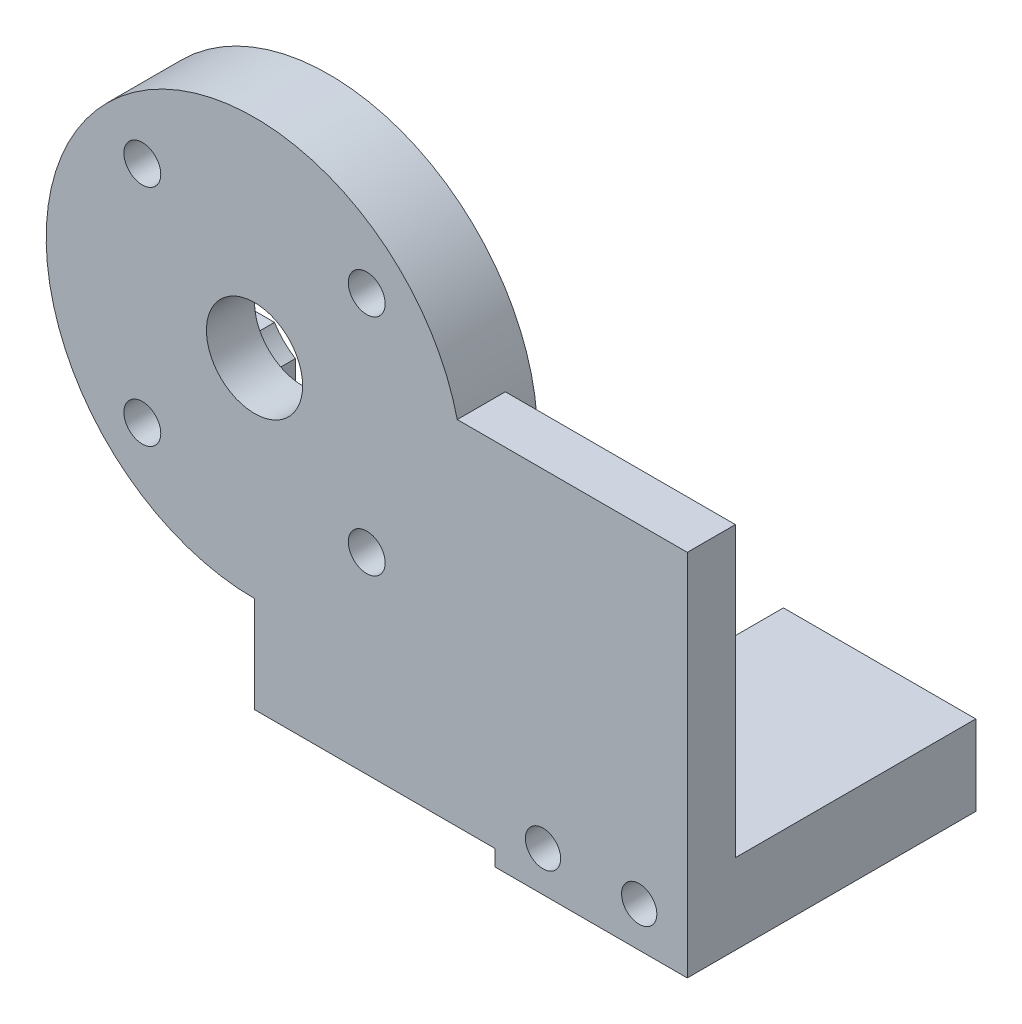
from build123d import *

# Parameters (mm, degrees)
STOCK_HORN_ATTACHMENT_START          = 15
STOCK_HORN_ATTACHMENT_PROFILE_R      = 13
STOCK_HORN_ATTACHMENT_DEPTH          = 3
FINGER_ARM_START                     = 15
FINGER_ARM_PROFILE_W                 = 27
FINGER_ARM_PROFILE_H                 = 22
FINGER_ARM_DEPTH                     = 3
DESCENDING_CONTACT_FINGER_PROFILE_W  = 12
DESCENDING_CONTACT_FINGER_PROFILE_H  = 5
DESCENDING_CONTACT_FINGER_DEPTH      = 18
HORN_CENTER_ACCESS_START             = -50
HORN_CENTER_ACCESS_PROFILE_R         = 3
HORN_CENTER_ACCESS_DEPTH             = 89.118237105
CAPTURED_HORN_KEY_BOSS_START         = 13.35
CAPTURED_HORN_KEY_BOSS_PROFILE_R     = 13
CAPTURED_HORN_KEY_BOSS_DEPTH         = 1.65
KEY_POCKET_HUB_START                 = 13.35
STOCK_HORN_POCKET_HUB_R              = 3.55
KEY_POCKET_HUB_DEPTH                 = 1.65
KEY_POCKET_HORIZONTAL_START          = 13.35
STOCK_HORN_POCKET_HORIZONTAL_W       = 16.3
STOCK_HORN_POCKET_HORIZONTAL_H       = 4.2
KEY_POCKET_HORIZONTAL_DEPTH          = 1.65
KEY_POCKET_VERTICAL_START            = 13.35
STOCK_HORN_POCKET_VERTICAL_W         = 4.2
STOCK_HORN_POCKET_VERTICAL_H         = 16.3
KEY_POCKET_VERTICAL_DEPTH            = 1.65
KEY_POCKET_ROUNDED_TIPS_START        = 13.35
STOCK_HORN_POCKET_ROUNDED_TIPS_R     = 2.1
KEY_POCKET_ROUNDED_TIPS_DEPTH        = 1.65
UNMODIFIED_HORN_CAPTURE_M2_START     = -50
UNMODIFIED_HORN_CAPTURE_M2_PROFILE_R = 1.15
UNMODIFIED_HORN_CAPTURE_M2_DEPTH     = 89.118237105
HUB_CLEARANCE_IN_KEY_BOSS_ONLY_START = 13.35
HORN_CENTER_HUB_CLEARANCE_R          = 4
HUB_CLEARANCE_IN_KEY_BOSS_ONLY_DEPTH = 1.65
CONTACT_PAD_KEEPER_START             = -50
CONTACT_PAD_KEEPER_PROFILE_R         = 1.1
CONTACT_PAD_KEEPER_DEPTH             = 89.118237105


with BuildPart() as part:
    # Stock_horn_attachment_profile → Stock_horn_attachment (new body)
    with BuildSketch(Plane.XY.offset(STOCK_HORN_ATTACHMENT_START)):
        Circle(STOCK_HORN_ATTACHMENT_PROFILE_R)
    extrude(amount=STOCK_HORN_ATTACHMENT_DEPTH)

    # Finger_arm_profile → Finger_arm (add)
    with BuildSketch(Plane.XY.offset(FINGER_ARM_START)):
        with Locations((13.5, -8)):
            Rectangle(FINGER_ARM_PROFILE_W, FINGER_ARM_PROFILE_H)
    extrude(amount=FINGER_ARM_DEPTH)

    # Descending_contact_finger_profile → Descending_contact_finger (add)
    with BuildSketch(Plane.XY):
        with Locations((21, -17.5)):
            Rectangle(DESCENDING_CONTACT_FINGER_PROFILE_W, DESCENDING_CONTACT_FINGER_PROFILE_H)
    extrude(amount=DESCENDING_CONTACT_FINGER_DEPTH)

    # Horn_center_access_profile → Horn_center_access (cut, through all)
    with BuildSketch(Plane.XY.offset(HORN_CENTER_ACCESS_START)):
        Circle(HORN_CENTER_ACCESS_PROFILE_R)
    extrude(amount=HORN_CENTER_ACCESS_DEPTH, mode=Mode.SUBTRACT)

    # Captured_horn_key_boss_profile → Captured_horn_key_boss (add)
    with BuildSketch(Plane.XY.offset(CAPTURED_HORN_KEY_BOSS_START)):
        with Locations(Location((0, 0, 0), (0, 0, 270))):
            Circle(CAPTURED_HORN_KEY_BOSS_PROFILE_R)
    extrude(amount=CAPTURED_HORN_KEY_BOSS_DEPTH)

    # Stock_horn_pocket_Hub → Key_pocket_Hub (cut)
    with BuildSketch(Plane.XY.offset(KEY_POCKET_HUB_START)):
        Circle(STOCK_HORN_POCKET_HUB_R)
    extrude(amount=KEY_POCKET_HUB_DEPTH, mode=Mode.SUBTRACT)

    # Stock_horn_pocket_Horizontal → Key_pocket_Horizontal (cut)
    with BuildSketch(Plane.XY.offset(KEY_POCKET_HORIZONTAL_START)):
        Rectangle(STOCK_HORN_POCKET_HORIZONTAL_W, STOCK_HORN_POCKET_HORIZONTAL_H)
    extrude(amount=KEY_POCKET_HORIZONTAL_DEPTH, mode=Mode.SUBTRACT)

    # Stock_horn_pocket_Vertical → Key_pocket_Vertical (cut)
    with BuildSketch(Plane.XY.offset(KEY_POCKET_VERTICAL_START)):
        Rectangle(STOCK_HORN_POCKET_VERTICAL_W, STOCK_HORN_POCKET_VERTICAL_H)
    extrude(amount=KEY_POCKET_VERTICAL_DEPTH, mode=Mode.SUBTRACT)

    # Stock_horn_pocket_Rounded_tips → Key_pocket_Rounded_tips (cut)
    with BuildSketch(Plane.XY.offset(KEY_POCKET_ROUNDED_TIPS_START)):
        with Locations((8.15, 0)):
            Circle(STOCK_HORN_POCKET_ROUNDED_TIPS_R)
        with Locations((-8.15, 0)):
            Circle(STOCK_HORN_POCKET_ROUNDED_TIPS_R)
        with Locations((0, 8.15)):
            Circle(STOCK_HORN_POCKET_ROUNDED_TIPS_R)
        with Locations((0, -8.15)):
            Circle(STOCK_HORN_POCKET_ROUNDED_TIPS_R)
    extrude(amount=KEY_POCKET_ROUNDED_TIPS_DEPTH, mode=Mode.SUBTRACT)

    # Unmodified_horn_capture_M2_profile → Unmodified_horn_capture_M2 (cut, through all)
    with BuildSketch(Plane.XY.offset(UNMODIFIED_HORN_CAPTURE_M2_START)):
        with Locations((7, 7)):
            Circle(UNMODIFIED_HORN_CAPTURE_M2_PROFILE_R)
        with Locations((-7, 7)):
            Circle(UNMODIFIED_HORN_CAPTURE_M2_PROFILE_R)
        with Locations((-7, -7)):
            Circle(UNMODIFIED_HORN_CAPTURE_M2_PROFILE_R)
        with Locations((7, -7)):
            Circle(UNMODIFIED_HORN_CAPTURE_M2_PROFILE_R)
    extrude(amount=UNMODIFIED_HORN_CAPTURE_M2_DEPTH, mode=Mode.SUBTRACT)

    # Horn_center_hub_clearance → Hub_clearance_in_key_boss_only (cut)
    with BuildSketch(Plane.XY.offset(HUB_CLEARANCE_IN_KEY_BOSS_ONLY_START)):
        Circle(HORN_CENTER_HUB_CLEARANCE_R)
    extrude(amount=HUB_CLEARANCE_IN_KEY_BOSS_ONLY_DEPTH, mode=Mode.SUBTRACT)

    # Contact_pad_keeper_profile → Contact_pad_keeper (cut, through all)
    with BuildSketch(Plane.XY.offset(CONTACT_PAD_KEEPER_START)):
        with Locations(Location((18, -17.5, 0), (0, 0, 180))):
            Circle(CONTACT_PAD_KEEPER_PROFILE_R)
        with Locations(Location((24, -17.5, 0), (0, 0, 180))):
            Circle(CONTACT_PAD_KEEPER_PROFILE_R)
    extrude(amount=CONTACT_PAD_KEEPER_DEPTH, mode=Mode.SUBTRACT)


solid = part.part
